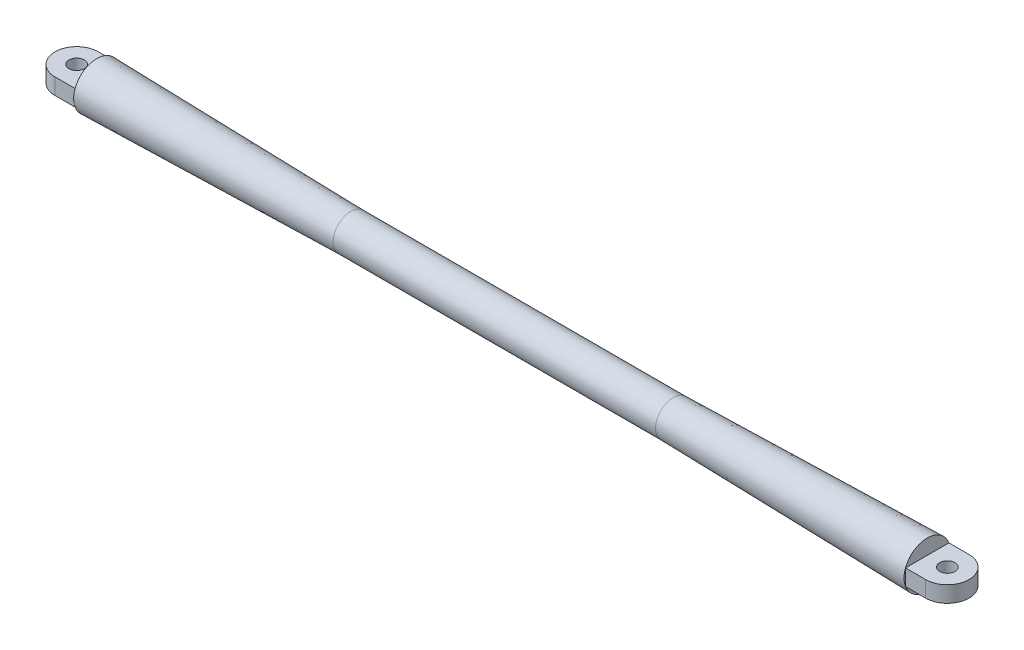
from build123d import *

# Parameters (mm, degrees)
CUT_EXTRUDE1_DEPTH      = 577.563092818
CUT_EXTRUDE1_DEPTH_BACK = 577.563092818
SKETCH2_W               = 89.636865708
SKETCH2_H               = 33.75527561
CUT_EXTRUDE2_DEPTH      = 578.082523042
CUT_EXTRUDE2_DEPTH_BACK = 578.082523042
SKETCH4_R               = 9.5
CUT_EXTRUDE3_DEPTH      = 569.968860373


with BuildPart() as part:
    # Sketch1 → Revolve1 (revolve)
    with BuildSketch(Plane(origin=(0, 0, 0), x_dir=(1, 0, 0), z_dir=(0, 1, 0)), mode=Mode.PRIVATE) as revolve1_sk:
        Polygon((0, 0), (575, 0), (575, 30), (200, 22), (0, 22), align=None)
    revolve(revolve1_sk.sketch.rotate(Axis((0, 0, 0), (1, 0, 0)), 180), axis=Axis((0, 0, 0), (1, 0, 0)))

    # Sketch2 → Cut-Extrude1 (cut, two sides: drawn at the far end of the back side and taken through both)
    with BuildSketch(Plane.XY.offset(-CUT_EXTRUDE1_DEPTH_BACK)):
        with Locations((559.818432854, 26.877637805)):
            Rectangle(SKETCH2_W, SKETCH2_H)
        with Locations((559.818432854, -26.877637805)):
            Rectangle(SKETCH2_W, SKETCH2_H)
    extrude(amount=CUT_EXTRUDE1_DEPTH + CUT_EXTRUDE1_DEPTH_BACK, mode=Mode.SUBTRACT)

    # Sketch3 → Cut-Extrude2 (cut, two sides: drawn at the far end of the back side and taken through both)
    with BuildSketch(Plane(origin=(0, 10, 0), x_dir=(1, 0, 0), z_dir=(0, 1, 0)).offset(-CUT_EXTRUDE2_DEPTH_BACK)):
        with BuildLine():
            Line((515, 26.922823032), (540, 26.922823032))
            ThreePointArc((540, 26.922823032), (566.922823032, 0), (540, -26.922823032))
            Line((540, -26.922823032), (515, -26.922823032))
            Line((515, -26.922823032), (515, -47.422504926))
            Line((515, -47.422504926), (621.137380003, -49.686769033))
            Line((621.137380003, -49.686769033), (621.137380003, -26.922823032))
            Line((621.137380003, -26.922823032), (621.137380003, 52.056019134))
            Line((621.137380003, 52.056019134), (515, 52.056019134))
            Line((515, 52.056019134), (515, 26.922823032))
        make_face()
    extrude(amount=CUT_EXTRUDE2_DEPTH + CUT_EXTRUDE2_DEPTH_BACK, mode=Mode.SUBTRACT)

    # Sketch4 → Cut-Extrude3 (cut, through all)
    with BuildSketch(Plane(origin=(0, 10, 0), x_dir=(1, 0, 0), z_dir=(0, 1, 0))):
        with Locations(Location((540, 0, 0), (0, 0, 180))):
            Circle(SKETCH4_R)
    extrude(amount=-CUT_EXTRUDE3_DEPTH, mode=Mode.SUBTRACT)

    # Mirror1: part across plane


with BuildPart() as part_1:
    add(part.part)
    add(part.part.mirror(Plane(origin=(0, 0, -22), x_dir=(0, 0, 1), z_dir=(1, 0, 0))))


solid = part_1.part
